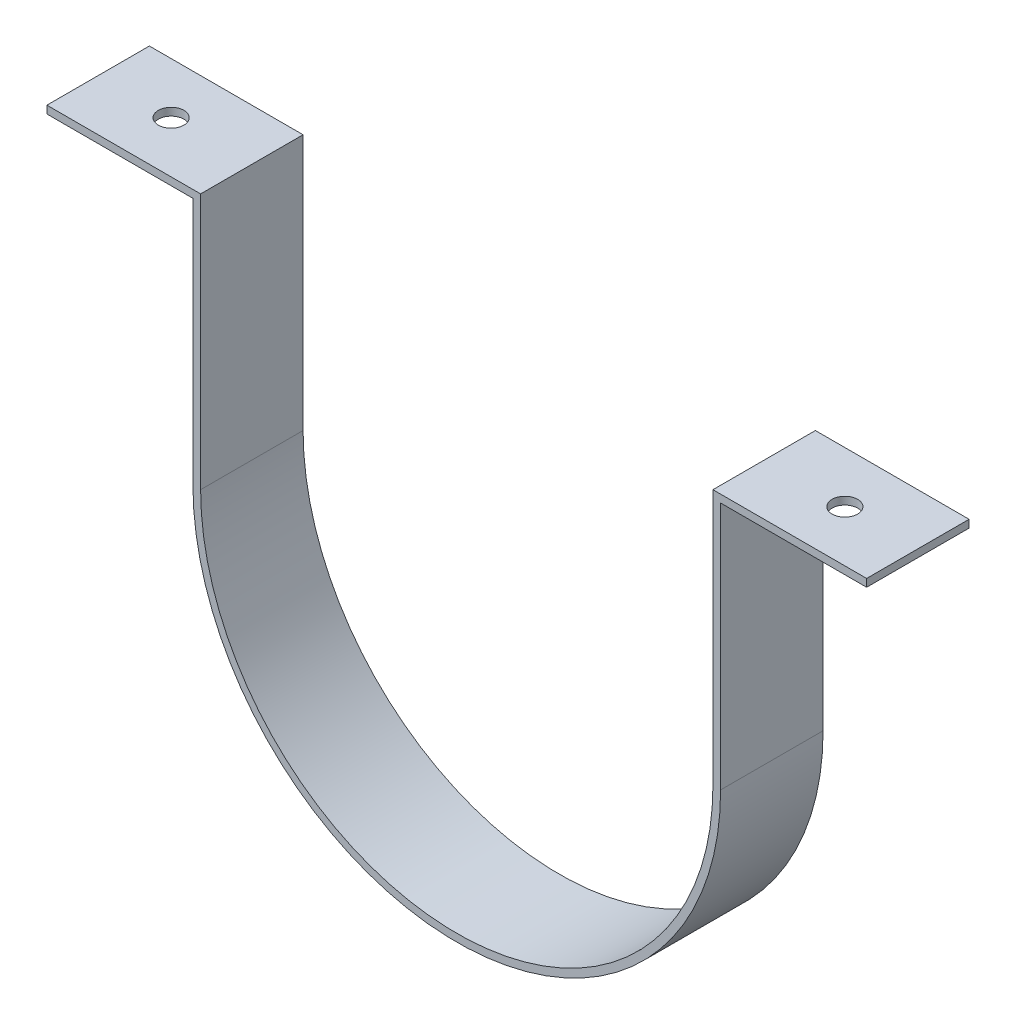
from build123d import *

# Parameters (mm, degrees)
RESSALTO_EXTRUS_O1_DEPTH = 20
ESBO_O2_R                = 2.5
CORTE_EXTRUS_O2_DEPTH    = 2


with BuildPart() as part:
    # Esboço1 → Ressalto-extrusão1 (new body)
    with BuildSketch(Plane.XY):
        with BuildLine():
            Line((191.678372413, 42.279236252), (191.678372413, -7.720763748))
            ThreePointArc((191.678372413, -7.720763748), (141.678372413, -57.720763748), (91.678372413, -7.720763748))
            Line((91.678372413, -7.720763748), (91.678372413, 42.279236252))
            Line((91.678372413, 42.279236252), (61.678372413, 42.279236252))
            Line((61.678372413, 42.279236252), (61.678372413, 40.779236252))
            Line((61.678372413, 40.779236252), (90.178372413, 40.779236252))
            Line((90.178372413, 40.779236252), (90.178372413, -7.720763748))
            ThreePointArc((90.178372413, -7.720763748), (141.678372413, -59.220763748), (193.178372413, -7.720763748))
            Line((193.178372413, -7.720763748), (193.178372413, 40.779236252))
            Line((193.178372413, 40.779236252), (221.678372413, 40.779236252))
            Line((221.678372413, 40.779236252), (221.678372413, 42.279236252))
            Line((221.678372413, 42.279236252), (191.678372413, 42.279236252))
        make_face()
    extrude(amount=RESSALTO_EXTRUS_O1_DEPTH)

    # Esboço2 → Corte-extrusão2 (cut)
    with BuildSketch(Plane.XZ.offset(-40.779236252)):
        with Locations(Location((75.928372413, 10, 0), (0, 0, 270))):
            Circle(ESBO_O2_R)
        with Locations(Location((207.428372413, 10, 0), (0, 0, 270))):
            Circle(ESBO_O2_R)
    extrude(amount=-CORTE_EXTRUS_O2_DEPTH, mode=Mode.SUBTRACT)


solid = part.part
